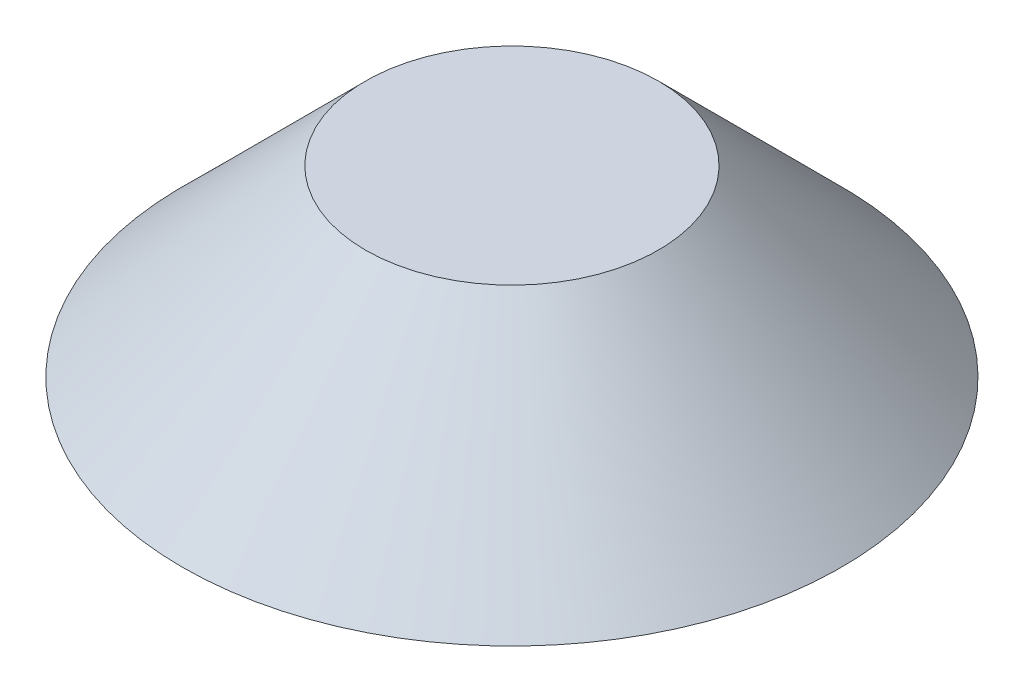
from build123d import *

# Parameters (mm, degrees)
SKETCH2_R                = 1.8
BOSS_EXTRUDE1_DEPTH      = 3
BOSS_EXTRUDE2_START      = -3.5
BOSS_EXTRUDE2_DEPTH      = 1.5
CIRPATTERN1_COUNT        = 4
CIRPATTERN1_START        = -3.5
CIRPATTERN1_COPY_1_DEPTH = 1.5
CIRPATTERN1_COPY_2_DEPTH = 1.5
CIRPATTERN1_COPY_3_DEPTH = 1.5


with BuildPart() as part:
    # Sketch1 → Revolve1 (revolve)
    with BuildSketch(Plane.XY, mode=Mode.PRIVATE) as revolve1_sk:
        Polygon((60, 75), (0, 75), (0, 72.878679656), (59.121320344, 72.878679656), (132, 0), (135, 0), align=None)
    revolve(revolve1_sk.sketch.rotate(Axis((0, 141.591796875, 0), (0, -1, 0)), 90), axis=Axis((0, 141.591796875, 0), (0, -1, 0)))

    # Sketch2 → Boss-Extrude1 (add)
    with BuildSketch(Plane(origin=(0, 0, 0), x_dir=(1, 0, 0), z_dir=(0, 1, 0))):
        with BuildLine():
            Line((-120.75, -3.3), (-120.75, 3.3))
            ThreePointArc((-120.75, 3.3), (-121.438035515, 5.085204769), (-123.14620757, 5.946887522))
            ThreePointArc((-123.14620757, 5.946887522), (-128.444404248, 6.952667825), (-131.50757947, 11.391072901))
            ThreePointArc((-131.50757947, 11.391072901), (-132, 0), (-131.50757947, -11.391072901))
            ThreePointArc((-131.50757947, -11.391072901), (-128.444404248, -6.952667825), (-123.14620757, -5.946887522))
            ThreePointArc((-123.14620757, -5.946887522), (-121.438035515, -5.085204769), (-120.75, -3.3))
        make_face()
        with Locations(Location((-125.55, 0, 0), (0, 0, 270))):
            Circle(SKETCH2_R, mode=Mode.SUBTRACT)
    boss_extrude1 = extrude(amount=BOSS_EXTRUDE1_DEPTH)

    # Sketch4 → Boss-Extrude2 (add)
    with BuildSketch(Plane.XY.offset(BOSS_EXTRUDE2_START)):
        with BuildLine():
            Line((-121.597685774, 3), (-128.899479074, 3))
            Line((-128.899479074, 3), (-123.706805235, 8.133451452))
            ThreePointArc((-123.706805235, 8.133451452), (-124.372605084, 4.859902275), (-121.597685774, 3))
        make_face()
    boss_extrude2 = extrude(amount=-BOSS_EXTRUDE2_DEPTH)

    # Mirror1: Boss-Extrude2 across plane
    add(boss_extrude2.mirror(Plane.XY))

    # CirPattern1: Boss-Extrude1, Boss-Extrude2 ×4 about axis
    cirpattern1_axis = Axis((0, 0, 0), (0, 1, 0))
    add([boss_extrude1.rotate(cirpattern1_axis, i * 360 / CIRPATTERN1_COUNT) for i in range(1, CIRPATTERN1_COUNT)])
    add([boss_extrude2.rotate(cirpattern1_axis, i * 360 / CIRPATTERN1_COUNT) for i in range(1, CIRPATTERN1_COUNT)])

    # CirPattern1 copy 1 sketch → CirPattern1 copy 1 (add)
    with BuildSketch(Plane(origin=(0, 0, 0), x_dir=(0, 0, -1), z_dir=(-1, 0, 0)).offset(CIRPATTERN1_START)):
        with BuildLine():
            Line((-121.597685774, -3), (-128.899479074, -3))
            Line((-128.899479074, -3), (-123.706805235, -8.133451452))
            ThreePointArc((-123.706805235, -8.133451452), (-124.372605084, -4.859902275), (-121.597685774, -3))
        make_face()
    extrude(amount=-CIRPATTERN1_COPY_1_DEPTH)

    # CirPattern1 copy 2 sketch → CirPattern1 copy 2 (add)
    with BuildSketch(Plane(origin=(0, 0, 0), x_dir=(-1, 0, 0), z_dir=(0, 0, 1)).offset(CIRPATTERN1_START)):
        with BuildLine():
            Line((-121.597685774, -3), (-128.899479074, -3))
            Line((-128.899479074, -3), (-123.706805235, -8.133451452))
            ThreePointArc((-123.706805235, -8.133451452), (-124.372605084, -4.859902275), (-121.597685774, -3))
        make_face()
    extrude(amount=-CIRPATTERN1_COPY_2_DEPTH)

    # CirPattern1 copy 3 sketch → CirPattern1 copy 3 (add)
    with BuildSketch(Plane(origin=(0, 0, 0), x_dir=(0, 0, 1), z_dir=(1, 0, 0)).offset(CIRPATTERN1_START)):
        with BuildLine():
            Line((-121.597685774, -3), (-128.899479074, -3))
            Line((-128.899479074, -3), (-123.706805235, -8.133451452))
            ThreePointArc((-123.706805235, -8.133451452), (-124.372605084, -4.859902275), (-121.597685774, -3))
        make_face()
    extrude(amount=-CIRPATTERN1_COPY_3_DEPTH)


solid = part.part
